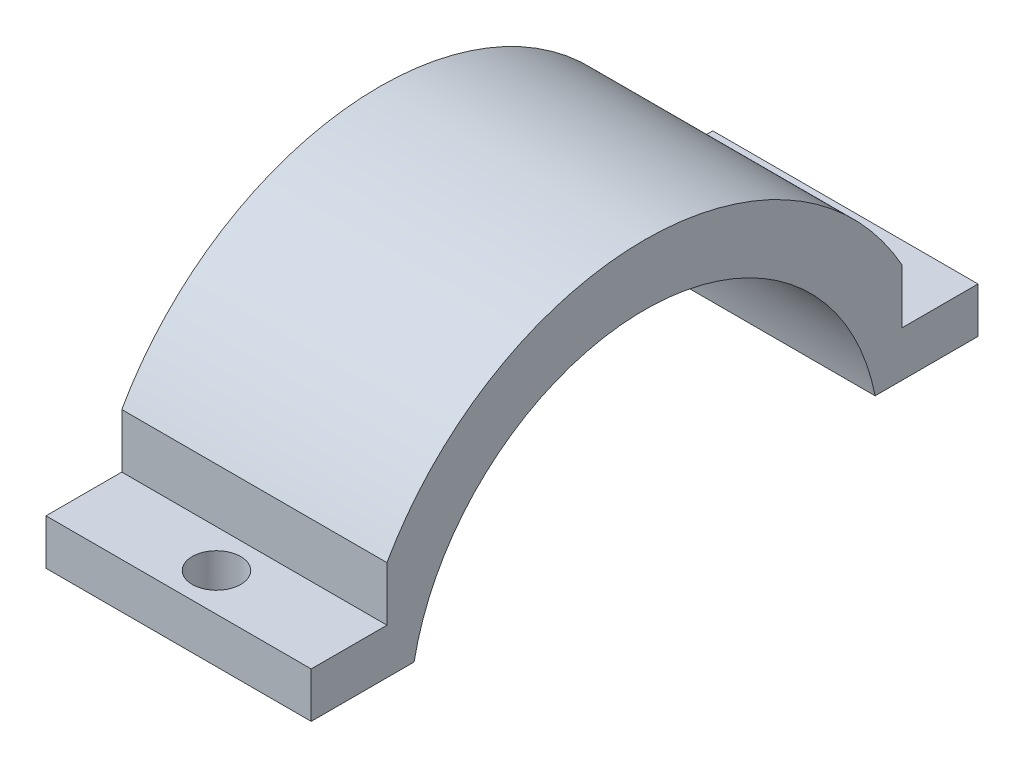
from build123d import *

# Parameters (mm, degrees)
SKETCH_1_W               = 17
SKETCH_1_H               = 40
EXTRUDE_1_DEPTH          = 50
SKETCH_2_W               = 17
SKETCH_2_H               = 1
CUT_EXTRUDE_1_DEPTH      = 67.2495283
SKETCH_4_W               = 0.5
SKETCH_4_H               = 39
EXTRUDE_2_DEPTH          = 50
SKETCH_5_R               = 15.5
CUT_EXTRUDE_2_DEPTH      = 17.5
CUT_EXTRUDE_3_DEPTH      = 17.5
CUT_EXTRUDE_4_DEPTH      = 3
CUT_EXTRUDE_START        = -64
CUT_EXTRUDE_7_DEPTH      = 64
SKETCH_9_W               = 5
SKETCH_9_H               = 3
EXTRUDE_3_DEPTH          = 17.5
CUT_EXTRUDE_8_DEPTH      = 54.087192429
CUT_EXTRUDE_8_DEPTH_BACK = 54.087192429
CUT_EXTRUDE_10_REACH     = 51.07
CUT_EXTRUDE_11_REACH     = 55.087


with BuildPart() as part:
    # 草图1 → 凸台-拉伸1 (new body)
    with BuildSketch(Plane(origin=(0, 0, 0), x_dir=(1, 0, 0), z_dir=(0, 1, 0))):
        with Locations((8.5, -20)):
            Rectangle(SKETCH_1_W, SKETCH_1_H)
    extrude(amount=EXTRUDE_1_DEPTH)

    # 草图2 → 切除-拉伸1 (cut, through all)
    with BuildSketch(Plane.XZ):
        with Locations((8.5, 39.5)):
            Rectangle(SKETCH_2_W, SKETCH_2_H)
    extrude(amount=-CUT_EXTRUDE_1_DEPTH, mode=Mode.SUBTRACT)

    # 草图4 → 凸台-拉伸2 (add)
    with BuildSketch(Plane.XZ):
        with Locations((-0.25, 19.5)):
            Rectangle(SKETCH_4_W, SKETCH_4_H)
    extrude(amount=-EXTRUDE_2_DEPTH)

    # 草图5 → 切除-拉伸2 (cut)
    with BuildSketch(Plane(origin=(17, 0, 0), x_dir=(0, 0, -1), z_dir=(1, 0, 0))):
        with Locations((-22, 4.5)):
            Circle(SKETCH_5_R)
    extrude(amount=-CUT_EXTRUDE_2_DEPTH, mode=Mode.SUBTRACT)

    # 草图6 → 切除-拉伸3 (cut)
    with BuildSketch(Plane(origin=(17, 0, 0), x_dir=(0, 0, -1), z_dir=(1, 0, 0))):
        Polygon((0, 3), (0, 24), (0, 50), (-39, 50), (-39, 24), (-22, 24), (-5, 24), (-5, 3), align=None)
    extrude(amount=-CUT_EXTRUDE_3_DEPTH, mode=Mode.SUBTRACT)

    # 草图7 → 切除-拉伸4 (cut)
    with BuildSketch(Plane(origin=(0, 3, 0), x_dir=(1, 0, 0), z_dir=(0, 1, 0))):
        with BuildLine():
            ThreePointArc((8.25, -0.9), (6.65, -2.5), (8.25, -4.1))
            Line((8.25, -4.1), (8.25, -0.9))
        make_face()
        with BuildLine():
            Line((8.25, -0.9), (8.25, -4.1))
            ThreePointArc((8.25, -4.1), (9.38137085, -3.63137085), (9.85, -2.5))
            ThreePointArc((9.85, -2.5), (9.38137085, -1.36862915), (8.25, -0.9))
        make_face()
    extrude(amount=-CUT_EXTRUDE_4_DEPTH, mode=Mode.SUBTRACT)

    # 草图8 → 切除-拉伸7 (cut)
    with BuildSketch(Plane.ZY.offset(0.5).offset(CUT_EXTRUDE_START)):
        with BuildLine():
            Line((5, 3), (5, 4.5))
            Line((5, 4.5), (-8.613521725, 4.5))
            Line((-8.613521725, 4.5), (17.256515703, -28.446816898))
            Line((17.256515703, -28.446816898), (39, 0))
            Line((39, 0), (36.832396974, 0))
            ThreePointArc((36.832396974, 0), (22, -11), (7.167603026, 0))
            Line((7.167603026, 0), (0, 0))
            Line((0, 0), (0, 3))
            Line((0, 3), (5, 3))
        make_face()
        with BuildLine():
            ThreePointArc((7.167603026, 0), (6.667809141, 2.225373998), (6.5, 4.5))
            Line((6.5, 4.5), (5, 4.5))
            Line((5, 4.5), (5, 3))
            Line((5, 3), (0, 3))
            Line((0, 3), (0, 0))
            Line((0, 0), (7.167603026, 0))
        make_face()
        with BuildLine():
            Line((37.5, 4.5), (22, 4.5))
            Line((22, 4.5), (6.5, 4.5))
            ThreePointArc((6.5, 4.5), (6.667809141, 2.225373998), (7.167603026, 0))
            ThreePointArc((7.167603026, 0), (22, -11), (36.832396974, 0))
            ThreePointArc((36.832396974, 0), (37.332190859, 2.225373998), (37.5, 4.5))
        make_face()
        with BuildLine():
            Line((6.5, 4.5), (22, 4.5))
            Line((22, 4.5), (37.5, 4.5))
            ThreePointArc((37.5, 4.5), (22, 20), (6.5, 4.5))
        make_face()
        with BuildLine():
            Line((39, 4.5), (37.5, 4.5))
            ThreePointArc((37.5, 4.5), (37.332190859, 2.225373998), (36.832396974, 0))
            Line((36.832396974, 0), (39, 0))
            Line((39, 0), (39, 4.5))
        make_face()
    extrude(amount=CUT_EXTRUDE_7_DEPTH, mode=Mode.SUBTRACT)

    # 草图9 → 凸台-拉伸3 (add)
    with BuildSketch(Plane.ZY.offset(0.5)):
        with Locations((41.5, 8.978432147)):
            Rectangle(SKETCH_9_W, SKETCH_9_H)
        with Locations((2.5, 8.978432147)):
            Rectangle(SKETCH_9_W, SKETCH_9_H)
    extrude(amount=-EXTRUDE_3_DEPTH)

    # 草图10 → 切除-拉伸8 (cut, two sides: drawn at the far end of the back side and taken through both)
    with BuildSketch(Plane.ZY.offset(0.5).offset(-CUT_EXTRUDE_8_DEPTH_BACK)):
        with BuildLine():
            Line((5, 24), (5, 14.052486587))
            ThreePointArc((5, 14.052486587), (12.151738439, 21.330381583), (22, 24))
            Line((22, 24), (5, 24))
        make_face()
        with BuildLine():
            Line((39, 24), (22, 24))
            ThreePointArc((22, 24), (31.848261561, 21.330381583), (39, 14.052486587))
            Line((39, 14.052486587), (39, 24))
        make_face()
    extrude(amount=CUT_EXTRUDE_8_DEPTH + CUT_EXTRUDE_8_DEPTH_BACK, mode=Mode.SUBTRACT)

    # 草图12 → 切除-拉伸10 (cut, up to next)
    with BuildSketch(Plane(origin=(0, 10.478432147, 0), x_dir=(1, 0, 0), z_dir=(0, 1, 0)), mode=Mode.PRIVATE) as cut_extrude_10_sk1:
        with BuildLine():
            ThreePointArc((9.85, -41.5), (9.38137085, -40.36862915), (8.25, -39.9))
            Line((8.25, -39.9), (8.25, -43.1))
            ThreePointArc((8.25, -43.1), (9.38137085, -42.63137085), (9.85, -41.5))
        make_face()
    cut_extrude_10_tool1 = extrude(cut_extrude_10_sk1.sketch, amount=-CUT_EXTRUDE_10_REACH, mode=Mode.PRIVATE) & part.part
    # 草图12 → 切除-拉伸10 (cut, up to next)
    with BuildSketch(Plane(origin=(0, 10.478432147, 0), x_dir=(1, 0, 0), z_dir=(0, 1, 0)), mode=Mode.PRIVATE) as cut_extrude_10_sk2:
        with BuildLine():
            Line((8.25, -43.1), (8.25, -39.9))
            ThreePointArc((8.25, -39.9), (6.65, -41.5), (8.25, -43.1))
        make_face()
    cut_extrude_10_tool2 = extrude(cut_extrude_10_sk2.sketch, amount=-CUT_EXTRUDE_10_REACH, mode=Mode.PRIVATE) & part.part
    # 草图12 → 切除-拉伸10 (cut, up to next)
    with BuildSketch(Plane(origin=(0, 10.478432147, 0), x_dir=(1, 0, 0), z_dir=(0, 1, 0)), mode=Mode.PRIVATE) as cut_extrude_10_sk3:
        with BuildLine():
            ThreePointArc((9.85, -41.5), (9.38137085, -40.36862915), (8.25, -39.9))
            Line((8.25, -39.9), (8.25, -43.1))
            ThreePointArc((8.25, -43.1), (9.38137085, -42.63137085), (9.85, -41.5))
        make_face()
    cut_extrude_10_tool3 = extrude(cut_extrude_10_sk3.sketch, amount=-CUT_EXTRUDE_10_REACH, mode=Mode.PRIVATE) & part.part
    # 草图12 → 切除-拉伸10 (cut, up to next)
    with BuildSketch(Plane(origin=(0, 10.478432147, 0), x_dir=(1, 0, 0), z_dir=(0, 1, 0)), mode=Mode.PRIVATE) as cut_extrude_10_sk4:
        with BuildLine():
            Line((8.25, -43.1), (8.25, -39.9))
            ThreePointArc((8.25, -39.9), (6.65, -41.5), (8.25, -43.1))
        make_face()
    cut_extrude_10_tool4 = extrude(cut_extrude_10_sk4.sketch, amount=-CUT_EXTRUDE_10_REACH, mode=Mode.PRIVATE) & part.part
    # 草图12 → 切除-拉伸10 (cut, up to next)
    with BuildSketch(Plane(origin=(0, 10.478432147, 0), x_dir=(1, 0, 0), z_dir=(0, 1, 0)), mode=Mode.PRIVATE) as cut_extrude_10_sk5:
        with BuildLine():
            ThreePointArc((9.85, -2.5), (9.38137085, -1.36862915), (8.25, -0.9))
            Line((8.25, -0.9), (8.25, -4.1))
            ThreePointArc((8.25, -4.1), (9.38137085, -3.63137085), (9.85, -2.5))
        make_face()
    cut_extrude_10_tool5 = extrude(cut_extrude_10_sk5.sketch, amount=-CUT_EXTRUDE_10_REACH, mode=Mode.PRIVATE) & part.part
    # 草图12 → 切除-拉伸10 (cut, up to next)
    with BuildSketch(Plane(origin=(0, 10.478432147, 0), x_dir=(1, 0, 0), z_dir=(0, 1, 0)), mode=Mode.PRIVATE) as cut_extrude_10_sk6:
        with BuildLine():
            Line((8.25, -4.1), (8.25, -0.9))
            ThreePointArc((8.25, -0.9), (6.65, -2.5), (8.25, -4.1))
        make_face()
    cut_extrude_10_tool6 = extrude(cut_extrude_10_sk6.sketch, amount=-CUT_EXTRUDE_10_REACH, mode=Mode.PRIVATE) & part.part
    # 草图12 → 切除-拉伸10 (cut, up to next)
    with BuildSketch(Plane(origin=(0, 10.478432147, 0), x_dir=(1, 0, 0), z_dir=(0, 1, 0)), mode=Mode.PRIVATE) as cut_extrude_10_sk7:
        with BuildLine():
            ThreePointArc((9.85, -2.5), (9.38137085, -1.36862915), (8.25, -0.9))
            Line((8.25, -0.9), (8.25, -4.1))
            ThreePointArc((8.25, -4.1), (9.38137085, -3.63137085), (9.85, -2.5))
        make_face()
    cut_extrude_10_tool7 = extrude(cut_extrude_10_sk7.sketch, amount=-CUT_EXTRUDE_10_REACH, mode=Mode.PRIVATE) & part.part
    # 草图12 → 切除-拉伸10 (cut, up to next)
    with BuildSketch(Plane(origin=(0, 10.478432147, 0), x_dir=(1, 0, 0), z_dir=(0, 1, 0)), mode=Mode.PRIVATE) as cut_extrude_10_sk8:
        with BuildLine():
            Line((8.25, -4.1), (8.25, -0.9))
            ThreePointArc((8.25, -0.9), (6.65, -2.5), (8.25, -4.1))
        make_face()
    cut_extrude_10_tool8 = extrude(cut_extrude_10_sk8.sketch, amount=-CUT_EXTRUDE_10_REACH, mode=Mode.PRIVATE) & part.part
    add(cut_extrude_10_tool1.solids().sort_by_distance((8.929061, 10.478432, 41.5))[0], mode=Mode.SUBTRACT)
    add(cut_extrude_10_tool2.solids().sort_by_distance((7.570939, 10.478432, 41.5))[0], mode=Mode.SUBTRACT)
    add(cut_extrude_10_tool3.solids().sort_by_distance((8.929061, 10.478432, 41.5))[0], mode=Mode.SUBTRACT)
    add(cut_extrude_10_tool4.solids().sort_by_distance((7.570939, 10.478432, 41.5))[0], mode=Mode.SUBTRACT)
    add(cut_extrude_10_tool5.solids().sort_by_distance((8.929061, 10.478432, 2.5))[0], mode=Mode.SUBTRACT)
    add(cut_extrude_10_tool6.solids().sort_by_distance((7.570939, 10.478432, 2.5))[0], mode=Mode.SUBTRACT)
    add(cut_extrude_10_tool7.solids().sort_by_distance((8.929061, 10.478432, 2.5))[0], mode=Mode.SUBTRACT)
    add(cut_extrude_10_tool8.solids().sort_by_distance((7.570939, 10.478432, 2.5))[0], mode=Mode.SUBTRACT)

    # 草图13 → 切除-拉伸11 (cut, up to next)
    with BuildSketch(Plane(origin=(17, 0, 0), x_dir=(0, 0, -1), z_dir=(1, 0, 0)), mode=Mode.PRIVATE) as cut_extrude_11_sk1:
        Polygon((-39, 7.478432147), (-37.21114532, 7.478432147), (-37.5, 4.5), (-39, 4.5), align=None)
    cut_extrude_11_tool1 = extrude(cut_extrude_11_sk1.sketch, amount=-CUT_EXTRUDE_11_REACH, mode=Mode.PRIVATE) & part.part
    # 草图13 → 切除-拉伸11 (cut, up to next)
    with BuildSketch(Plane(origin=(17, 0, 0), x_dir=(0, 0, -1), z_dir=(1, 0, 0)), mode=Mode.PRIVATE) as cut_extrude_11_sk2:
        Polygon((-5, 7.478432147), (-6.78885468, 7.478432147), (-6.5, 4.5), (-5, 4.5), align=None)
    cut_extrude_11_tool2 = extrude(cut_extrude_11_sk2.sketch, amount=-CUT_EXTRUDE_11_REACH, mode=Mode.PRIVATE) & part.part
    add(cut_extrude_11_tool1.solids().sort_by_distance((17, 6.032815, 38.175672))[0], mode=Mode.SUBTRACT)
    add(cut_extrude_11_tool2.solids().sort_by_distance((17, 6.032815, 5.824328))[0], mode=Mode.SUBTRACT)


solid = part.part
